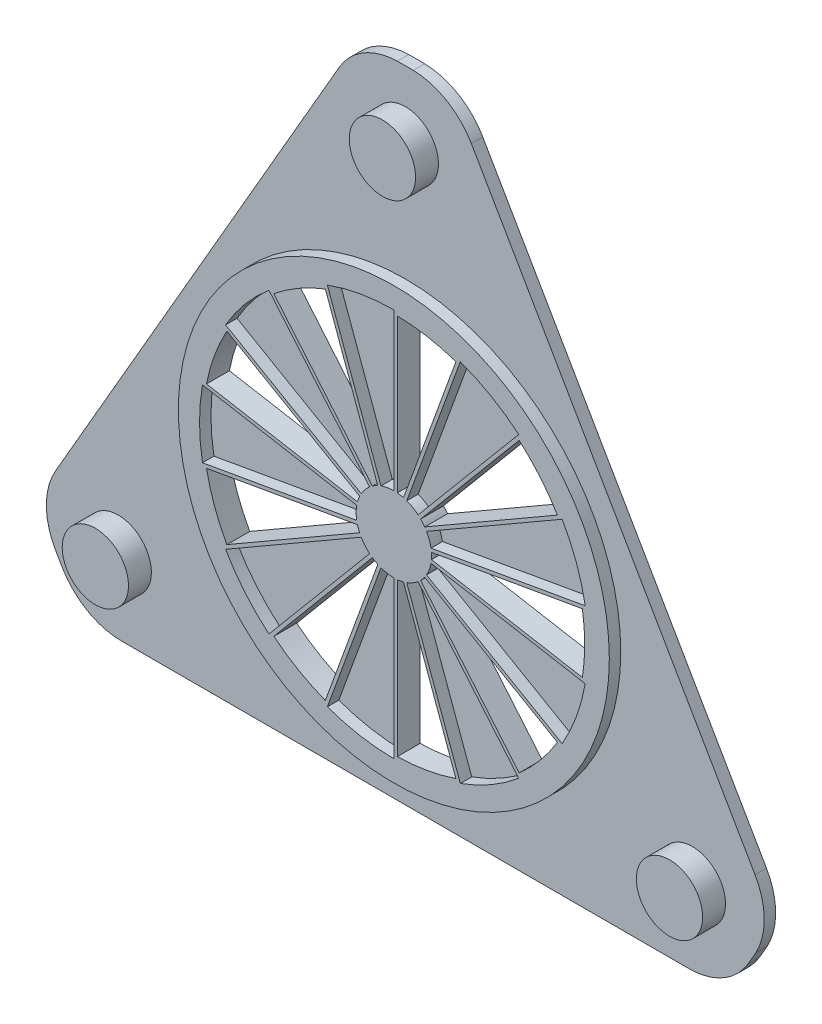
from build123d import *
from build123d.topology import SkipClean

# Parameters (mm, degrees)
SKETCH2_R           = 18.85
BOSS_EXTRUDE1_DEPTH = 2
BOSS_EXTRUDE7_START = -1
BOSS_EXTRUDE7_DEPTH = 1
BOSS_EXTRUDE9_START = -2
SKETCH17_R          = 3.3
BOSS_EXTRUDE9_DEPTH = 2
SKETCH9_R           = 3.098061326
BOSS_EXTRUDE5_DEPTH = 2
BOSS_EXTRUDE2_START = -1
SKETCH3_R           = 35
SKETCH3_R_2         = 18.85
BOSS_EXTRUDE2_DEPTH = 1
SKETCH4_R           = 2.9
BOSS_EXTRUDE3_DEPTH = 3
SKETCH6_R           = 5
BOSS_EXTRUDE4_DEPTH = 1
SKETCH7_R           = 59.131365533
CUT_EXTRUDE1_DEPTH  = 10
FILLET1_R           = 6


with BuildPart() as part:
    # Sketch2 → Boss-Extrude1 (new body)
    # profile 1 of 37: a face of its own
    with BuildSketch(Plane.XY.offset(10)):
        Circle(SKETCH2_R)
        with BuildLine():
            ThreePointArc((-5.814342437, 15.974774553), (-2.95201902, 16.741731801), (0, 17))
            ThreePointArc((0, 17), (2.95201902, 16.741731801), (5.814342437, 15.974774553))
            ThreePointArc((5.814342437, 15.974774553), (8.5, 14.722431864), (10.927389365, 13.022755533))
            ThreePointArc((10.927389365, 13.022755533), (13.022755533, 10.927389365), (14.722431864, 8.5))
            ThreePointArc((14.722431864, 8.5), (15.974774553, 5.814342437), (16.741731801, 2.95201902))
            ThreePointArc((16.741731801, 2.95201902), (16.935309868, 1.481647627), (17, 0))
            ThreePointArc((17, 0), (16.935309868, -1.481647627), (16.741731801, -2.95201902))
            ThreePointArc((16.741731801, -2.95201902), (15.974774553, -5.814342437), (14.722431864, -8.5))
            ThreePointArc((14.722431864, -8.5), (13.022755533, -10.927389365), (10.927389365, -13.022755533))
            ThreePointArc((10.927389365, -13.022755533), (8.5, -14.722431864), (5.814342437, -15.974774553))
            ThreePointArc((5.814342437, -15.974774553), (2.95201902, -16.741731801), (0, -17))
            ThreePointArc((0, -17), (-2.95201902, -16.741731801), (-5.814342437, -15.974774553))
            ThreePointArc((-5.814342437, -15.974774553), (-8.5, -14.722431864), (-10.927389365, -13.022755533))
            ThreePointArc((-10.927389365, -13.022755533), (-13.022755533, -10.927389365), (-14.722431864, -8.5))
            ThreePointArc((-14.722431864, -8.5), (-15.974774553, -5.814342437), (-16.741731801, -2.95201902))
            ThreePointArc((-16.741731801, -2.95201902), (-17, 0), (-16.741731801, 2.95201902))
            ThreePointArc((-16.741731801, 2.95201902), (-15.974774553, 5.814342437), (-14.722431864, 8.5))
            ThreePointArc((-14.722431864, 8.5), (-13.022755533, 10.927389365), (-10.927389365, 13.022755533))
            ThreePointArc((-10.927389365, 13.022755533), (-8.5, 14.722431864), (-5.814342437, 15.974774553))
        make_face(mode=Mode.SUBTRACT)
    # profile 2 of 37: a face of its own
    with BuildSketch(Plane.XY.offset(10)):
        with BuildLine():
            Line((0, 17), (0, 16.697537549))
            ThreePointArc((0, 16.697537549), (0.150006053, 16.696863729), (0.3, 16.694842323))
            ThreePointArc((0.3, 16.694842323), (2.899496967, 16.443864434), (5.428064578, 15.790626179))
            ThreePointArc((5.428064578, 15.790626179), (5.569704144, 15.741224728), (5.710894186, 15.69055282))
            Line((5.710894186, 15.69055282), (5.814342437, 15.974774553))
            ThreePointArc((5.814342437, 15.974774553), (2.95201902, 16.741731801), (0, 17))
        make_face()
    # profile 3 of 37: a face of its own
    with BuildSketch(Plane.XY.offset(10)):
        with BuildLine():
            ThreePointArc((-5.99188015, 15.585414093), (-5.851623307, 15.638614544), (-5.710894186, 15.69055282))
            Line((-5.710894186, 15.69055282), (-5.814342437, 15.974774553))
            ThreePointArc((-5.814342437, 15.974774553), (-8.5, 14.722431864), (-10.927389365, 13.022755533))
            Line((-10.927389365, 13.022755533), (-10.732970249, 12.791055853))
            ThreePointArc((-10.732970249, 12.791055853), (-10.617625822, 12.886961709), (-10.501424458, 12.981827473))
            ThreePointArc((-10.501424458, 12.981827473), (-8.348768774, 14.460491698), (-5.99188015, 15.585414093))
        make_face()
    # profile 4 of 37: a face of its own
    with BuildSketch(Plane.XY.offset(10)):
        with BuildLine():
            ThreePointArc((-14.608157564, 8.08761354), (-14.534911179, 8.218522811), (-14.460491698, 8.348768774))
            Line((-14.460491698, 8.348768774), (-14.722431864, 8.5))
            ThreePointArc((-14.722431864, 8.5), (-15.974774553, 5.814342437), (-16.741731801, 2.95201902))
            Line((-16.741731801, 2.95201902), (-16.443864434, 2.899496967))
            ThreePointArc((-16.443864434, 2.899496967), (-16.417152573, 3.047107084), (-16.389115702, 3.194471272))
            ThreePointArc((-16.389115702, 3.194471272), (-15.69055282, 5.710894186), (-14.608157564, 8.08761354))
        make_face()
    # profile 5 of 37: a face of its own
    with BuildSketch(Plane.XY.offset(10)):
        with BuildLine():
            ThreePointArc((-16.389115702, -3.194471272), (-16.417152573, -3.047107084), (-16.443864434, -2.899496967))
            Line((-16.443864434, -2.899496967), (-16.741731801, -2.95201902))
            ThreePointArc((-16.741731801, -2.95201902), (-15.974774553, -5.814342437), (-14.722431864, -8.5))
            Line((-14.722431864, -8.5), (-14.460491698, -8.348768774))
            ThreePointArc((-14.460491698, -8.348768774), (-14.534911179, -8.218522811), (-14.608157564, -8.08761354))
            ThreePointArc((-14.608157564, -8.08761354), (-15.69055282, -5.710894186), (-16.389115702, -3.194471272))
        make_face()
    # profile 6 of 37: a face of its own
    with BuildSketch(Plane.XY.offset(10)):
        with BuildLine():
            ThreePointArc((-10.501424458, -12.981827473), (-10.617625822, -12.886961709), (-10.732970249, -12.791055853))
            Line((-10.732970249, -12.791055853), (-10.927389365, -13.022755533))
            ThreePointArc((-10.927389365, -13.022755533), (-8.5, -14.722431864), (-5.814342437, -15.974774553))
            Line((-5.814342437, -15.974774553), (-5.710894186, -15.69055282))
            ThreePointArc((-5.710894186, -15.69055282), (-5.851623307, -15.638614544), (-5.99188015, -15.585414093))
            ThreePointArc((-5.99188015, -15.585414093), (-8.348768774, -14.460491698), (-10.501424458, -12.981827473))
        make_face()
    # profile 7 of 37: a face of its own
    with BuildSketch(Plane.XY.offset(10)):
        with BuildLine():
            Line((5.814342437, -15.974774553), (5.710894186, -15.69055282))
            ThreePointArc((5.710894186, -15.69055282), (5.569704144, -15.741224728), (5.428064578, -15.790626179))
            ThreePointArc((5.428064578, -15.790626179), (2.899496967, -16.443864434), (0.3, -16.694842323))
            ThreePointArc((0.3, -16.694842323), (0.150006053, -16.696863729), (0, -16.697537549))
            Line((0, -16.697537549), (0, -17))
            ThreePointArc((0, -17), (2.95201902, -16.741731801), (5.814342437, -15.974774553))
        make_face()
    # profile 8 of 37: a face of its own
    with BuildSketch(Plane.XY.offset(10)):
        with BuildLine():
            Line((14.722431864, -8.5), (14.460491698, -8.348768774))
            ThreePointArc((14.460491698, -8.348768774), (14.384905126, -8.478340917), (14.308157564, -8.607228783))
            ThreePointArc((14.308157564, -8.607228783), (12.791055853, -10.732970249), (10.961051124, -12.596154907))
            ThreePointArc((10.961051124, -12.596154907), (10.847448429, -12.694117644), (10.732970249, -12.791055853))
            Line((10.732970249, -12.791055853), (10.927389365, -13.022755533))
            ThreePointArc((10.927389365, -13.022755533), (13.022755533, -10.927389365), (14.722431864, -8.5))
        make_face()
    # profile 9 of 37: a face of its own
    with BuildSketch(Plane.XY.offset(10)):
        with BuildLine():
            ThreePointArc((0.842085099, 3.190751116), (0.986397435, 3.149130054), (1.128666473, 3.100985649))
            Line((1.128666473, 3.100985649), (5.710894186, 15.69055282))
            ThreePointArc((5.710894186, 15.69055282), (5.569704144, 15.741224728), (5.428064578, 15.790626179))
            Line((5.428064578, 15.790626179), (0.842085099, 3.190751116))
        make_face()
    # profile 10 of 37: a face of its own
    with BuildSketch(Plane.XY.offset(10)):
        with BuildLine():
            Line((0, 16.697537549), (0, 3.3))
            ThreePointArc((0, 3.3), (0.150155522, 3.296582066), (0.3, 3.286335345))
            Line((0.3, 3.286335345), (0.3, 16.694842323))
            ThreePointArc((0.3, 16.694842323), (0.150006053, 16.696863729), (0, 16.697537549))
        make_face()
    # profile 11 of 37: a face of its own
    with BuildSketch(Plane.XY.offset(10)):
        with BuildLine():
            ThreePointArc((-1.405900672, 2.98553903), (-1.268597506, 3.046417628), (-1.128666473, 3.100985649))
            Line((-1.128666473, 3.100985649), (-5.710894186, 15.69055282))
            ThreePointArc((-5.710894186, 15.69055282), (-5.851623307, 15.638614544), (-5.99188015, 15.585414093))
            Line((-5.99188015, 15.585414093), (-1.405900672, 2.98553903))
        make_face()
    # profile 12 of 37: a face of its own
    with BuildSketch(Plane.XY.offset(10)):
        with BuildLine():
            Line((-10.732970249, 12.791055853), (-2.121199112, 2.527946662))
            ThreePointArc((-2.121199112, 2.527946662), (-2.003976303, 2.621846482), (-1.882602308, 2.710315212))
            Line((-1.882602308, 2.710315212), (-10.501424458, 12.981827473))
            ThreePointArc((-10.501424458, 12.981827473), (-10.617625822, 12.886961709), (-10.732970249, 12.791055853))
        make_face()
    # profile 13 of 37: a face of its own
    with BuildSketch(Plane.XY.offset(10)):
        with BuildLine():
            ThreePointArc((-2.996049894, 1.383360051), (-2.930001576, 1.518252537), (-2.857883832, 1.65))
            Line((-2.857883832, 1.65), (-14.460491698, 8.348768774))
            ThreePointArc((-14.460491698, 8.348768774), (-14.534911179, 8.218522811), (-14.608157564, 8.08761354))
            Line((-14.608157564, 8.08761354), (-2.996049894, 1.383360051))
        make_face()
    # profile 14 of 37: a face of its own
    with BuildSketch(Plane.XY.offset(10)):
        with BuildLine():
            Line((-16.443864434, 2.899496967), (-3.249865585, 0.573038986))
            ThreePointArc((-3.249865585, 0.573038986), (-3.220425345, 0.72031979), (-3.184314073, 0.86610847))
            Line((-3.184314073, 0.86610847), (-16.389115702, 3.194471272))
            ThreePointArc((-16.389115702, 3.194471272), (-16.417152573, 3.047107084), (-16.443864434, 2.899496967))
        make_face()
    # profile 15 of 37: a face of its own
    with BuildSketch(Plane.XY.offset(10)):
        with BuildLine():
            ThreePointArc((-3.184314073, -0.86610847), (-3.220425345, -0.72031979), (-3.249865585, -0.573038986))
            Line((-3.249865585, -0.573038986), (-16.443864434, -2.899496967))
            ThreePointArc((-16.443864434, -2.899496967), (-16.417152573, -3.047107084), (-16.389115702, -3.194471272))
            Line((-16.389115702, -3.194471272), (-3.184314073, -0.86610847))
        make_face()
    # profile 16 of 37: a face of its own
    with BuildSketch(Plane.XY.offset(10)):
        with BuildLine():
            Line((-14.460491698, -8.348768774), (-2.857883832, -1.65))
            ThreePointArc((-2.857883832, -1.65), (-2.930001576, -1.518252537), (-2.996049894, -1.383360051))
            Line((-2.996049894, -1.383360051), (-14.608157564, -8.08761354))
            ThreePointArc((-14.608157564, -8.08761354), (-14.534911179, -8.218522811), (-14.460491698, -8.348768774))
        make_face()
    # profile 17 of 37: a face of its own
    with BuildSketch(Plane.XY.offset(10)):
        with BuildLine():
            ThreePointArc((-1.882602308, -2.710315212), (-2.003976303, -2.621846482), (-2.121199112, -2.527946662))
            Line((-2.121199112, -2.527946662), (-10.732970249, -12.791055853))
            ThreePointArc((-10.732970249, -12.791055853), (-10.617625822, -12.886961709), (-10.501424458, -12.981827473))
            Line((-10.501424458, -12.981827473), (-1.882602308, -2.710315212))
        make_face()
    # profile 18 of 37: a face of its own
    with BuildSketch(Plane.XY.offset(10)):
        with BuildLine():
            Line((-5.710894186, -15.69055282), (-1.128666473, -3.100985649))
            ThreePointArc((-1.128666473, -3.100985649), (-1.268597506, -3.046417628), (-1.405900672, -2.98553903))
            Line((-1.405900672, -2.98553903), (-5.99188015, -15.585414093))
            ThreePointArc((-5.99188015, -15.585414093), (-5.851623307, -15.638614544), (-5.710894186, -15.69055282))
        make_face()
    # profile 19 of 37: a face of its own
    with BuildSketch(Plane.XY.offset(10)):
        with BuildLine():
            ThreePointArc((0.3, -3.286335345), (0.150155522, -3.296582066), (0, -3.3))
            Line((0, -3.3), (0, -16.697537549))
            ThreePointArc((0, -16.697537549), (0.150006053, -16.696863729), (0.3, -16.694842323))
            Line((0.3, -16.694842323), (0.3, -3.286335345))
        make_face()
    # profile 20 of 37: a face of its own
    with BuildSketch(Plane.XY.offset(10)):
        with BuildLine():
            Line((5.710894186, -15.69055282), (1.128666473, -3.100985649))
            ThreePointArc((1.128666473, -3.100985649), (0.986397435, -3.149130054), (0.842085099, -3.190751116))
            Line((0.842085099, -3.190751116), (5.428064578, -15.790626179))
            ThreePointArc((5.428064578, -15.790626179), (5.569704144, -15.741224728), (5.710894186, -15.69055282))
        make_face()
    # profile 21 of 37: a face of its own
    with BuildSketch(Plane.XY.offset(10)):
        with BuildLine():
            ThreePointArc((2.342228974, -2.324642646), (2.234027909, -2.428810264), (2.121199112, -2.527946662))
            Line((2.121199112, -2.527946662), (10.732970249, -12.791055853))
            ThreePointArc((10.732970249, -12.791055853), (10.847448429, -12.694117644), (10.961051124, -12.596154907))
            Line((10.961051124, -12.596154907), (2.342228974, -2.324642646))
        make_face()
    # profile 22 of 37: a face of its own
    with BuildSketch(Plane.XY.offset(10)):
        with BuildLine():
            Line((14.460491698, -8.348768774), (2.857883832, -1.65))
            ThreePointArc((2.857883832, -1.65), (2.779846054, -1.778329529), (2.696049894, -1.902975294))
            Line((2.696049894, -1.902975294), (14.308157564, -8.607228783))
            ThreePointArc((14.308157564, -8.607228783), (14.384905126, -8.478340917), (14.460491698, -8.348768774))
        make_face()
    # profile 23 of 37: a face of its own
    with BuildSketch(Plane.XY.offset(10)):
        with BuildLine():
            Line((0, 3.3), (0, 2.988310559))
            ThreePointArc((0, 2.988310559), (0.518914683, 2.942911407), (1.022062406, 2.808093381))
            Line((1.022062406, 2.808093381), (1.128666473, 3.100985649))
            ThreePointArc((1.128666473, 3.100985649), (0.986397435, 3.149130054), (0.842085099, 3.190751116))
            ThreePointArc((0.842085099, 3.190751116), (0.573038986, 3.249865585), (0.3, 3.286335345))
            ThreePointArc((0.3, 3.286335345), (0.150155522, 3.296582066), (0, 3.3))
        make_face()
    # profile 24 of 37: a face of its own
    with BuildSketch(Plane.XY.offset(10)):
        with BuildLine():
            ThreePointArc((-1.920849002, 2.289178698), (-1.49415528, 2.587952859), (-1.022062406, 2.808093381))
            Line((-1.022062406, 2.808093381), (-1.128666473, 3.100985649))
            ThreePointArc((-1.128666473, 3.100985649), (-1.268597506, 3.046417628), (-1.405900672, 2.98553903))
            ThreePointArc((-1.405900672, 2.98553903), (-1.65, 2.857883832), (-1.882602308, 2.710315212))
            ThreePointArc((-1.882602308, 2.710315212), (-2.003976303, 2.621846482), (-2.121199112, 2.527946662))
            Line((-2.121199112, 2.527946662), (-1.920849002, 2.289178698))
        make_face()
    # profile 25 of 37: a face of its own
    with BuildSketch(Plane.XY.offset(10)):
        with BuildLine():
            ThreePointArc((-2.942911407, 0.518914683), (-2.808093381, 1.022062406), (-2.587952859, 1.49415528))
            Line((-2.587952859, 1.49415528), (-2.857883832, 1.65))
            ThreePointArc((-2.857883832, 1.65), (-2.930001576, 1.518252537), (-2.996049894, 1.383360051))
            ThreePointArc((-2.996049894, 1.383360051), (-3.100985649, 1.128666473), (-3.184314073, 0.86610847))
            ThreePointArc((-3.184314073, 0.86610847), (-3.220425345, 0.72031979), (-3.249865585, 0.573038986))
            Line((-3.249865585, 0.573038986), (-2.942911407, 0.518914683))
        make_face()
    # profile 26 of 37: a face of its own
    with BuildSketch(Plane.XY.offset(10)):
        with BuildLine():
            ThreePointArc((-2.587952859, -1.49415528), (-2.808093381, -1.022062406), (-2.942911407, -0.518914683))
            Line((-2.942911407, -0.518914683), (-3.249865585, -0.573038986))
            ThreePointArc((-3.249865585, -0.573038986), (-3.220425345, -0.72031979), (-3.184314073, -0.86610847))
            ThreePointArc((-3.184314073, -0.86610847), (-3.100985649, -1.128666473), (-2.996049894, -1.383360051))
            ThreePointArc((-2.996049894, -1.383360051), (-2.930001576, -1.518252537), (-2.857883832, -1.65))
            Line((-2.857883832, -1.65), (-2.587952859, -1.49415528))
        make_face()
    # profile 27 of 37: a face of its own
    with BuildSketch(Plane.XY.offset(10)):
        with BuildLine():
            ThreePointArc((-1.022062406, -2.808093381), (-1.49415528, -2.587952859), (-1.920849002, -2.289178698))
            Line((-1.920849002, -2.289178698), (-2.121199112, -2.527946662))
            ThreePointArc((-2.121199112, -2.527946662), (-2.003976303, -2.621846482), (-1.882602308, -2.710315212))
            ThreePointArc((-1.882602308, -2.710315212), (-1.65, -2.857883832), (-1.405900672, -2.98553903))
            ThreePointArc((-1.405900672, -2.98553903), (-1.268597506, -3.046417628), (-1.128666473, -3.100985649))
            Line((-1.128666473, -3.100985649), (-1.022062406, -2.808093381))
        make_face()
    # profile 28 of 37: a face of its own
    with BuildSketch(Plane.XY.offset(10)):
        with BuildLine():
            Line((1.128666473, -3.100985649), (1.022062406, -2.808093381))
            ThreePointArc((1.022062406, -2.808093381), (0.518914683, -2.942911407), (0, -2.988310559))
            Line((0, -2.988310559), (0, -3.3))
            ThreePointArc((0, -3.3), (0.150155522, -3.296582066), (0.3, -3.286335345))
            ThreePointArc((0.3, -3.286335345), (0.573038986, -3.249865585), (0.842085099, -3.190751116))
            ThreePointArc((0.842085099, -3.190751116), (0.986397435, -3.149130054), (1.128666473, -3.100985649))
        make_face()
    # profile 29 of 37: a face of its own
    with BuildSketch(Plane.XY.offset(10)):
        with BuildLine():
            Line((2.857883832, -1.65), (2.587952859, -1.49415528))
            ThreePointArc((2.587952859, -1.49415528), (2.289178698, -1.920849002), (1.920849002, -2.289178698))
            Line((1.920849002, -2.289178698), (2.121199112, -2.527946662))
            ThreePointArc((2.121199112, -2.527946662), (2.234027909, -2.428810264), (2.342228974, -2.324642646))
            ThreePointArc((2.342228974, -2.324642646), (2.527946662, -2.121199112), (2.696049894, -1.902975294))
            ThreePointArc((2.696049894, -1.902975294), (2.779846054, -1.778329529), (2.857883832, -1.65))
        make_face()
    # profile 30 of 37: a face of its own
    with BuildSketch(Plane.XY.offset(10)):
        with BuildLine():
            Line((3.249865585, 0.573038986), (2.942911407, 0.518914683))
            ThreePointArc((2.942911407, 0.518914683), (2.976939136, 0.260448426), (2.988310559, 0))
            ThreePointArc((2.988310559, 0), (2.976939136, -0.260448426), (2.942911407, -0.518914683))
            Line((2.942911407, -0.518914683), (3.249865585, -0.573038986))
            ThreePointArc((3.249865585, -0.573038986), (3.27257381, -0.424571146), (3.28850298, -0.275223818))
            ThreePointArc((3.28850298, -0.275223818), (3.297124492, -0.137731924), (3.3, 0))
            ThreePointArc((3.3, 0), (3.297124492, 0.137731924), (3.28850298, 0.275223818))
            ThreePointArc((3.28850298, 0.275223818), (3.27257381, 0.424571146), (3.249865585, 0.573038986))
        make_face()
    # profile 31 of 37: a face of its own
    with BuildSketch(Plane.XY.offset(10)):
        with BuildLine():
            ThreePointArc((3.28850298, -0.275223818), (3.27257381, -0.424571146), (3.249865585, -0.573038986))
            Line((3.249865585, -0.573038986), (16.443864434, -2.899496967))
            ThreePointArc((16.443864434, -2.899496967), (16.469249129, -2.751652835), (16.493304608, -2.60358662))
            Line((16.493304608, -2.60358662), (3.28850298, -0.275223818))
        make_face()
    # profile 32 of 37: a face of its own
    with BuildSketch(Plane.XY.offset(10)):
        with BuildLine():
            Line((16.443864434, 2.899496967), (3.249865585, 0.573038986))
            ThreePointArc((3.249865585, 0.573038986), (3.27257381, 0.424571146), (3.28850298, 0.275223818))
            Line((3.28850298, 0.275223818), (16.493304608, 2.60358662))
            ThreePointArc((16.493304608, 2.60358662), (16.469249129, 2.751652835), (16.443864434, 2.899496967))
        make_face()
    # profile 33 of 37: a face of its own
    with BuildSketch(Plane.XY.offset(10)):
        with BuildLine():
            Line((16.741731801, 2.95201902), (16.443864434, 2.899496967))
            ThreePointArc((16.443864434, 2.899496967), (16.469249129, 2.751652835), (16.493304608, 2.60358662))
            ThreePointArc((16.493304608, 2.60358662), (16.64640101, 1.305792325), (16.697537549, 0))
            ThreePointArc((16.697537549, 0), (16.64640101, -1.305792325), (16.493304608, -2.60358662))
            ThreePointArc((16.493304608, -2.60358662), (16.469249129, -2.751652835), (16.443864434, -2.899496967))
            Line((16.443864434, -2.899496967), (16.741731801, -2.95201902))
            ThreePointArc((16.741731801, -2.95201902), (16.935309868, -1.481647627), (17, 0))
            ThreePointArc((17, 0), (16.935309868, 1.481647627), (16.741731801, 2.95201902))
        make_face()
    # profile 34 of 37: a face of its own
    with BuildSketch(Plane.XY.offset(10)):
        with BuildLine():
            Line((2.121199112, 2.527946662), (1.920849002, 2.289178698))
            ThreePointArc((1.920849002, 2.289178698), (2.289178698, 1.920849002), (2.587952859, 1.49415528))
            Line((2.587952859, 1.49415528), (2.857883832, 1.65))
            ThreePointArc((2.857883832, 1.65), (2.779846054, 1.778329529), (2.696049894, 1.902975294))
            ThreePointArc((2.696049894, 1.902975294), (2.527946662, 2.121199112), (2.342228974, 2.324642646))
            ThreePointArc((2.342228974, 2.324642646), (2.234027909, 2.428810264), (2.121199112, 2.527946662))
        make_face()
    # profile 35 of 37: a face of its own
    with BuildSketch(Plane.XY.offset(10)):
        with BuildLine():
            ThreePointArc((2.696049894, 1.902975294), (2.779846054, 1.778329529), (2.857883832, 1.65))
            Line((2.857883832, 1.65), (14.460491698, 8.348768774))
            ThreePointArc((14.460491698, 8.348768774), (14.384905126, 8.478340917), (14.308157564, 8.607228783))
            Line((14.308157564, 8.607228783), (2.696049894, 1.902975294))
        make_face()
    # profile 36 of 37: a face of its own
    with BuildSketch(Plane.XY.offset(10)):
        with BuildLine():
            Line((10.732970249, 12.791055853), (2.121199112, 2.527946662))
            ThreePointArc((2.121199112, 2.527946662), (2.234027909, 2.428810264), (2.342228974, 2.324642646))
            Line((2.342228974, 2.324642646), (10.961051124, 12.596154907))
            ThreePointArc((10.961051124, 12.596154907), (10.847448429, 12.694117644), (10.732970249, 12.791055853))
        make_face()
    # profile 37 of 37: a face of its own
    with BuildSketch(Plane.XY.offset(10)):
        with BuildLine():
            Line((10.927389365, 13.022755533), (10.732970249, 12.791055853))
            ThreePointArc((10.732970249, 12.791055853), (10.847448429, 12.694117644), (10.961051124, 12.596154907))
            ThreePointArc((10.961051124, 12.596154907), (12.791055853, 10.732970249), (14.308157564, 8.607228783))
            ThreePointArc((14.308157564, 8.607228783), (14.384905126, 8.478340917), (14.460491698, 8.348768774))
            Line((14.460491698, 8.348768774), (14.722431864, 8.5))
            ThreePointArc((14.722431864, 8.5), (13.022755533, 10.927389365), (10.927389365, 13.022755533))
        make_face()
    extrude(amount=-BOSS_EXTRUDE1_DEPTH)

    # Sketch11 → Boss-Extrude7 (add)
    with SkipClean():  # the faces are left unmerged after this step: merging them gives an invalid solid
        with BuildSketch(Plane(origin=(0, 0, 8), x_dir=(-1, 0, 0), z_dir=(0, 0, -1)).offset(BOSS_EXTRUDE7_START)):
            with BuildLine():
                Line((12.116546443, 14.439937753), (1.920849002, 2.289178698))
                ThreePointArc((1.920849002, 2.289178698), (2.289178698, 1.920849002), (2.587952859, 1.49415528))
                Line((2.587952859, 1.49415528), (16.324578861, 9.425))
                ThreePointArc((16.324578861, 9.425), (14.439937753, 12.116546443), (12.116546443, 14.439937753))
            make_face()
            with BuildLine():
                Line((18.563626144, 3.273268149), (2.942911407, 0.518914683))
                ThreePointArc((2.942911407, 0.518914683), (2.976939136, 0.260448426), (2.988310559, 0))
                ThreePointArc((2.988310559, 0), (2.976939136, -0.260448426), (2.942911407, -0.518914683))
                Line((2.942911407, -0.518914683), (18.563626144, -3.273268149))
                ThreePointArc((18.563626144, -3.273268149), (18.85, 0), (18.563626144, 3.273268149))
            make_face()
            with BuildLine():
                Line((16.324578861, -9.425), (2.587952859, -1.49415528))
                ThreePointArc((2.587952859, -1.49415528), (2.289178698, -1.920849002), (1.920849002, -2.289178698))
                Line((1.920849002, -2.289178698), (12.116546443, -14.439937753))
                ThreePointArc((12.116546443, -14.439937753), (14.439937753, -12.116546443), (16.324578861, -9.425))
            make_face()
            with BuildLine():
                Line((6.447079702, -17.713205902), (1.022062406, -2.808093381))
                ThreePointArc((1.022062406, -2.808093381), (0.518914683, -2.942911407), (0, -2.988310559))
                Line((0, -2.988310559), (0, -18.85))
                ThreePointArc((0, -18.85), (3.273268149, -18.563626144), (6.447079702, -17.713205902))
            make_face()
            with BuildLine():
                ThreePointArc((-1.022062406, -2.808093381), (-1.49415528, -2.587952859), (-1.920849002, -2.289178698))
                Line((-1.920849002, -2.289178698), (-12.116546443, -14.439937753))
                ThreePointArc((-12.116546443, -14.439937753), (-9.425, -16.324578861), (-6.447079702, -17.713205902))
                Line((-6.447079702, -17.713205902), (-1.022062406, -2.808093381))
            make_face()
            with BuildLine():
                ThreePointArc((-2.587952859, -1.49415528), (-2.808093381, -1.022062406), (-2.942911407, -0.518914683))
                Line((-2.942911407, -0.518914683), (-18.563626144, -3.273268149))
                ThreePointArc((-18.563626144, -3.273268149), (-17.713205902, -6.447079702), (-16.324578861, -9.425))
                Line((-16.324578861, -9.425), (-2.587952859, -1.49415528))
            make_face()
            with BuildLine():
                ThreePointArc((-2.942911407, 0.518914683), (-2.808093381, 1.022062406), (-2.587952859, 1.49415528))
                Line((-2.587952859, 1.49415528), (-16.324578861, 9.425))
                ThreePointArc((-16.324578861, 9.425), (-17.713205902, 6.447079702), (-18.563626144, 3.273268149))
                Line((-18.563626144, 3.273268149), (-2.942911407, 0.518914683))
            make_face()
            with BuildLine():
                ThreePointArc((-1.920849002, 2.289178698), (-1.49415528, 2.587952859), (-1.022062406, 2.808093381))
                Line((-1.022062406, 2.808093381), (-6.447079702, 17.713205902))
                ThreePointArc((-6.447079702, 17.713205902), (-9.425, 16.324578861), (-12.116546443, 14.439937753))
                Line((-12.116546443, 14.439937753), (-1.920849002, 2.289178698))
            make_face()
            with BuildLine():
                Line((0, 18.85), (0, 2.988310559))
                ThreePointArc((0, 2.988310559), (0.518914683, 2.942911407), (1.022062406, 2.808093381))
                Line((1.022062406, 2.808093381), (6.447079702, 17.713205902))
                ThreePointArc((6.447079702, 17.713205902), (3.273268149, 18.563626144), (0, 18.85))
            make_face()
        extrude(amount=BOSS_EXTRUDE7_DEPTH)

    # Sketch17 → Boss-Extrude9 (add)
    with SkipClean():  # the faces are left unmerged after this step: merging them gives an invalid solid
        with BuildSketch(Plane(origin=(0, 0, 8), x_dir=(-1, 0, 0), z_dir=(0, 0, -1)).offset(BOSS_EXTRUDE9_START)):
            Circle(SKETCH17_R)
        extrude(amount=BOSS_EXTRUDE9_DEPTH)

    # Sketch9 → Boss-Extrude5 (add)
    with SkipClean():  # the faces are left unmerged after this step: merging them gives an invalid solid
        with BuildSketch(Plane.XY.offset(10)):
            Circle(SKETCH9_R)
        extrude(amount=-BOSS_EXTRUDE5_DEPTH)

    # Sketch3 → Boss-Extrude2 (add)
    with BuildSketch(Plane(origin=(0, 0, 8), x_dir=(-1, 0, 0), z_dir=(0, 0, -1)).offset(BOSS_EXTRUDE2_START)):
        Circle(SKETCH3_R)
        with Locations(Location((0, 0, 0), (0, 0, 180))):
            Circle(SKETCH3_R_2, mode=Mode.SUBTRACT)
    extrude(amount=BOSS_EXTRUDE2_DEPTH)

    # Sketch4 → Boss-Extrude3 (add)
    with BuildSketch(Plane(origin=(0, 0, 8), x_dir=(-1, 0, 0), z_dir=(0, 0, -1))):
        with Locations((0, 29)):
            Circle(SKETCH4_R)
        with Locations((25.11473671, -14.5)):
            Circle(SKETCH4_R)
        with Locations((-25.11473671, -14.5)):
            Circle(SKETCH4_R)
    extrude(amount=-BOSS_EXTRUDE3_DEPTH)

    # Sketch6 → Boss-Extrude4 (add)
    with BuildSketch(Plane(origin=(0, 0, 9), x_dir=(-1, 0, 0), z_dir=(0, 0, -1))):
        with Locations((0, 30)):
            Circle(SKETCH6_R)
        with Locations((25.980762114, -15)):
            Circle(SKETCH6_R)
        with Locations((-25.980762114, -15)):
            Circle(SKETCH6_R)
    extrude(amount=BOSS_EXTRUDE4_DEPTH)

    # Sketch7 → Cut-Extrude1 (cut)
    with BuildSketch(Plane(origin=(0, 0, 8), x_dir=(-1, 0, 0), z_dir=(0, 0, -1))):
        Circle(SKETCH7_R)
        Polygon((0, 42), (-36.373066959, -21), (36.373066959, -21), align=None, mode=Mode.SUBTRACT)
    extrude(amount=-CUT_EXTRUDE1_DEPTH, mode=Mode.SUBTRACT)

    # Fillet1
    fillet1_edges = [part.edges().sort_by_distance(p)[0] for p in [
        (-4.186533479, 34.748711306, 8.5),
        (-32.186533479, -13.748711306, 8.5),
        (-28, -21, 8.5),
        (28, -21, 8.5),
        (32.186533479, -13.748711306, 8.5),
        (4.186533479, 34.748711306, 8.5),
    ]]
    fillet(fillet1_edges, radius=FILLET1_R)


solid = part.part
